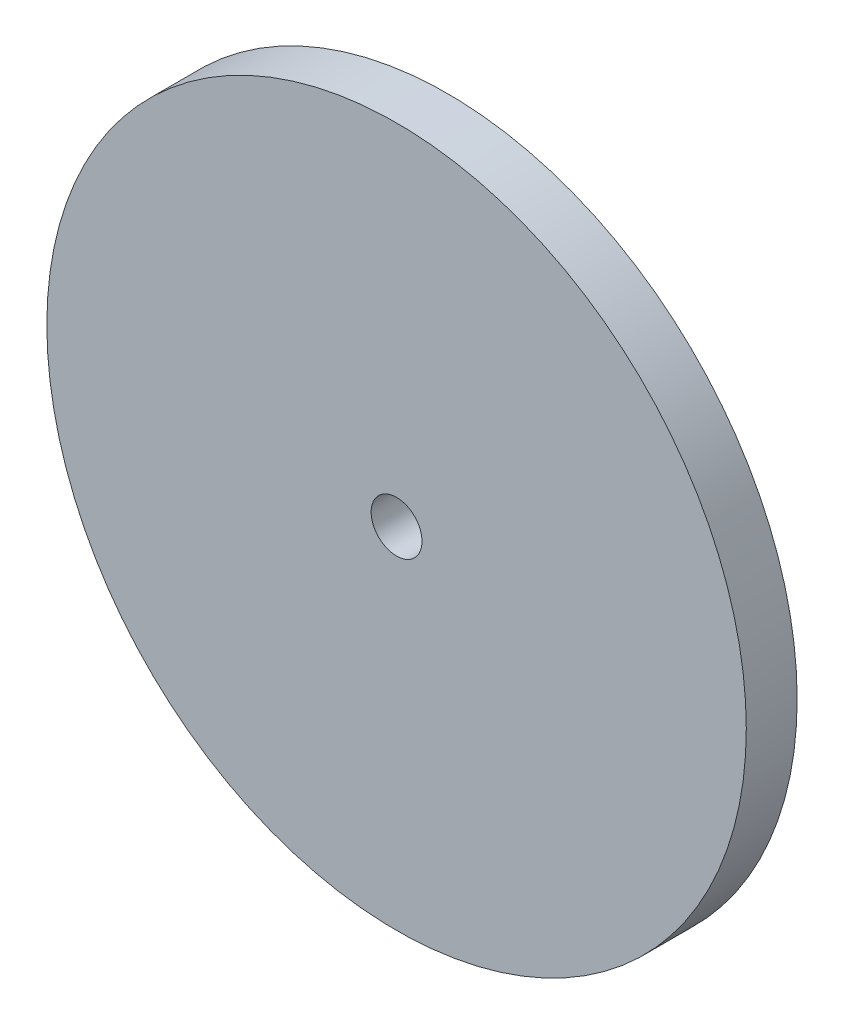
from build123d import *

# Parameters (mm, degrees)
ESQUISSE1_R             = 27.5
BOSS_EXTRU_1_DEPTH      = 4
ESQUISSE2_R             = 2
ENL_V_MAT_EXTRU_1_DEPTH = 2


with BuildPart() as part:
    # Esquisse1 → Boss.-Extru.1 (new body)
    with BuildSketch(Plane.XY):
        Circle(ESQUISSE1_R)
    extrude(amount=BOSS_EXTRU_1_DEPTH)

    # Esquisse2 → Enlèv. mat.-Extru.1 (cut, symmetric)
    with BuildSketch(Plane.XY.offset(2)):
        Circle(ESQUISSE2_R)
    extrude(amount=ENL_V_MAT_EXTRU_1_DEPTH, both=True, mode=Mode.SUBTRACT)


solid = part.part
